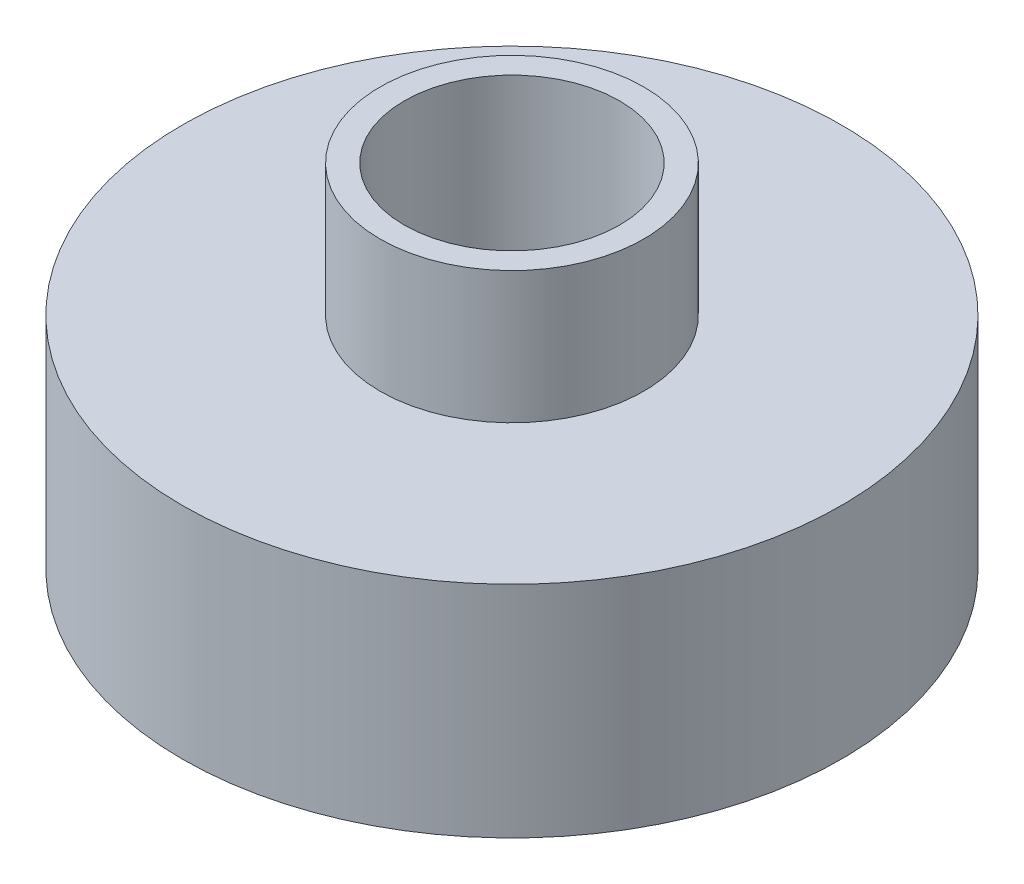
from build123d import *

# Parameters (mm, degrees)
SKETCH1_R           = 9.525
BOSS_EXTRUDE1_DEPTH = 6.35
SKETCH2_R           = 3.81
BOSS_EXTRUDE2_DEPTH = 3.81
SKETCH3_R           = 3.1115
CUT_EXTRUDE1_DEPTH  = 13.97


with BuildPart() as part:
    # Sketch1 → Boss-Extrude1 (new body)
    with BuildSketch(Plane(origin=(0, 0, 0), x_dir=(1, 0, 0), z_dir=(0, 1, 0))):
        with Locations(Location((0, 0, 0), (0, 0, 270))):
            Circle(SKETCH1_R)
    extrude(amount=BOSS_EXTRUDE1_DEPTH)

    # Sketch2 → Boss-Extrude2 (add)
    with BuildSketch(Plane(origin=(0, 6.35, 0), x_dir=(1, 0, 0), z_dir=(0, 1, 0))):
        with Locations(Location((0, 0, 0), (0, 0, 90))):
            Circle(SKETCH2_R)
    extrude(amount=BOSS_EXTRUDE2_DEPTH)

    # Sketch3 → Cut-Extrude1 (cut)
    with BuildSketch(Plane(origin=(0, 10.16, 0), x_dir=(1, 0, 0), z_dir=(0, 1, 0))):
        with Locations(Location((0, 0, 0), (0, 0, 270))):
            Circle(SKETCH3_R)
    extrude(amount=-CUT_EXTRUDE1_DEPTH, mode=Mode.SUBTRACT)


solid = part.part
